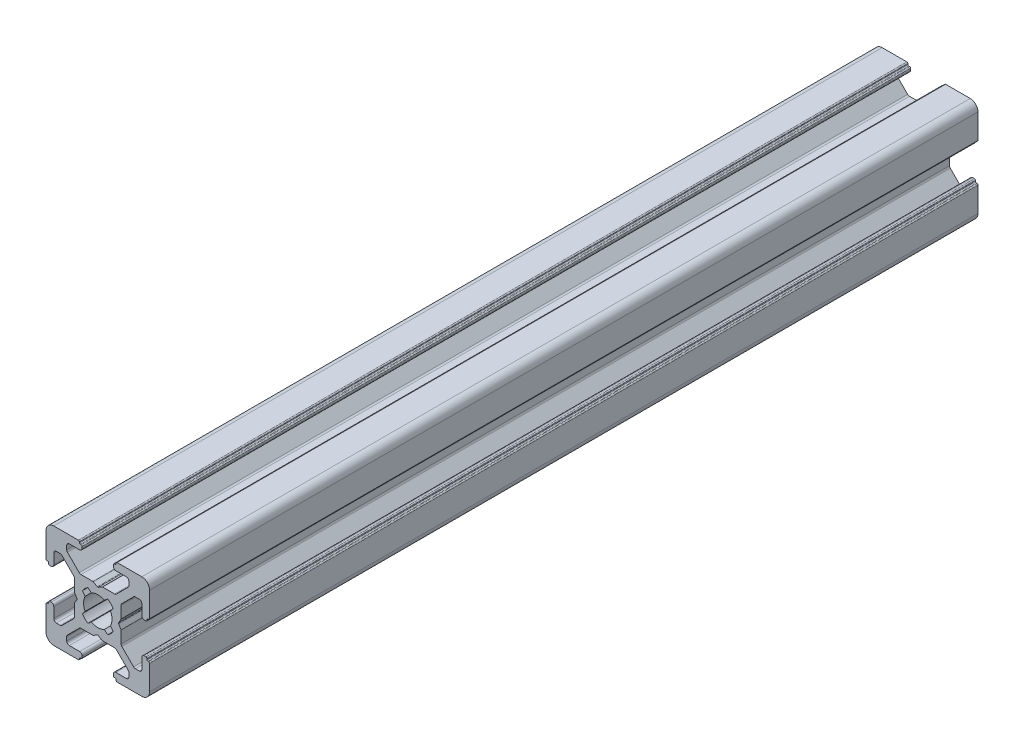
from build123d import *

# Parameters (mm, degrees)
EXTRUDE1_DEPTH = 160


with BuildPart() as part:
    # Sketch1 → Extrude1 (new body)
    with BuildSketch(Plane.XY):
        with BuildLine():
            Line((-3.5, 8.499999673), (-5.500000686, 8.499999673))
            ThreePointArc((-5.500000686, 8.499999673), (-5.853554077, 8.353553064), (-6.000000686, 7.999999673))
            Line((-6.000000686, 7.999999673), (-6.000000686, 7.267766626))
            ThreePointArc((-6.000000686, 7.267766626), (-5.961940448, 7.076424899), (-5.853554059, 6.914213219))
            Line((-5.853554059, 6.914213219), (-3.585787212, 4.646446592))
            ThreePointArc((-3.585787212, 4.646446592), (-3.423575544, 4.538060229), (-3.232233839, 4.5))
            Line((-3.232233839, 4.5), (-0.953590312, 4.5))
            ThreePointArc((-0.953590312, 4.5), (-0.901826505, 4.493185166), (-0.853590316, 4.473205083))
            Line((-0.853590316, 4.473205083), (-0.100000045, 4.038119562))
            ThreePointArc((-0.100000045, 4.038119562), (0, 4.011324632), (0.100000045, 4.038119562))
            Line((0.100000045, 4.038119562), (0.853590316, 4.473205083))
            ThreePointArc((0.853590316, 4.473205083), (0.901826505, 4.493185166), (0.953590312, 4.5))
            Line((0.953590312, 4.5), (3.232233839, 4.5))
            ThreePointArc((3.232233839, 4.5), (3.423575544, 4.538060229), (3.585787212, 4.646446592))
            Line((3.585787212, 4.646446592), (5.853554059, 6.914213219))
            ThreePointArc((5.853554059, 6.914213219), (5.961940448, 7.076424899), (6.000000686, 7.267766626))
            Line((6.000000686, 7.267766626), (6.000000686, 7.999999673))
            ThreePointArc((6.000000686, 7.999999673), (5.853554077, 8.353553064), (5.500000686, 8.499999673))
            Line((5.500000686, 8.499999673), (3.5, 8.499999673))
            ThreePointArc((3.5, 8.499999673), (3.146446609, 8.646446283), (3, 8.999999673))
            Line((3, 8.999999673), (3, 9.3))
            ThreePointArc((3, 9.3), (3.058578644, 9.441421356), (3.2, 9.5))
            Line((3.2, 9.5), (3.350000228, 9.5))
            ThreePointArc((3.350000228, 9.5), (3.491421584, 9.558578644), (3.550000228, 9.7))
            Line((3.550000228, 9.7), (3.550000228, 9.8))
            ThreePointArc((3.550000228, 9.8), (3.608578871, 9.941421356), (3.750000228, 10))
            Line((3.750000228, 10), (8.5, 10))
            ThreePointArc((8.5, 10), (9.560660172, 9.560660172), (10, 8.5))
            Line((10, 8.5), (10, 3.749999605))
            ThreePointArc((10, 3.749999605), (9.941421356, 3.608578248), (9.8, 3.549999605))
            Line((9.8, 3.549999605), (9.699999732, 3.549999605))
            ThreePointArc((9.699999732, 3.549999605), (9.558578376, 3.491420961), (9.499999732, 3.349999605))
            Line((9.499999732, 3.349999605), (9.499999732, 3.2))
            ThreePointArc((9.499999732, 3.2), (9.441421088, 3.058578644), (9.299999732, 3))
            Line((9.299999732, 3), (8.999999732, 3))
            ThreePointArc((8.999999732, 3), (8.646446341, 3.146446609), (8.499999732, 3.5))
            Line((8.499999732, 3.5), (8.499999732, 5.499999605))
            ThreePointArc((8.499999732, 5.499999605), (8.353553123, 5.853552995), (7.999999732, 5.999999605))
            Line((7.999999732, 5.999999605), (7.267766685, 5.999999605))
            ThreePointArc((7.267766685, 5.999999605), (7.076424969, 5.961939371), (6.914213294, 5.853552995))
            Line((6.914213294, 5.853552995), (4.646446398, 3.585786099))
            ThreePointArc((4.646446398, 3.585786099), (4.538060023, 3.423574425), (4.499999789, 3.232232708))
            Line((4.499999789, 3.232232708), (4.499999789, 0.953589302))
            ThreePointArc((4.499999789, 0.953589302), (4.493184953, 0.90182549), (4.473204867, 0.853589297))
            Line((4.473204867, 0.853589297), (4.038119841, 0.099999969))
            ThreePointArc((4.038119841, 0.099999969), (4.011324929, 0), (4.038119841, -0.099999969))
            Line((4.038119841, -0.099999969), (4.473204867, -0.853589297))
            ThreePointArc((4.473204867, -0.853589297), (4.493184953, -0.90182549), (4.499999789, -0.953589302))
            Line((4.499999789, -0.953589302), (4.499999789, -3.232232708))
            ThreePointArc((4.499999789, -3.232232708), (4.538060023, -3.423574425), (4.646446398, -3.585786099))
            Line((4.646446398, -3.585786099), (6.914213294, -5.853552995))
            ThreePointArc((6.914213294, -5.853552995), (7.076424969, -5.961939371), (7.267766685, -5.999999605))
            Line((7.267766685, -5.999999605), (7.999999732, -5.999999605))
            ThreePointArc((7.999999732, -5.999999605), (8.353553123, -5.853552995), (8.499999732, -5.499999605))
            Line((8.499999732, -5.499999605), (8.499999732, -3.5))
            ThreePointArc((8.499999732, -3.5), (8.646446341, -3.146446609), (8.999999732, -3))
            Line((8.999999732, -3), (9.299999732, -3))
            ThreePointArc((9.299999732, -3), (9.441421088, -3.058578644), (9.499999732, -3.2))
            Line((9.499999732, -3.2), (9.499999732, -3.349999605))
            ThreePointArc((9.499999732, -3.349999605), (9.558578376, -3.491420961), (9.699999732, -3.549999605))
            Line((9.699999732, -3.549999605), (9.8, -3.549999605))
            ThreePointArc((9.8, -3.549999605), (9.941421356, -3.608578248), (10, -3.749999605))
            Line((10, -3.749999605), (10, -8.5))
            ThreePointArc((10, -8.5), (9.560660172, -9.560660172), (8.5, -10))
            Line((8.5, -10), (3.750000228, -10))
            ThreePointArc((3.750000228, -10), (3.608578871, -9.941421356), (3.550000228, -9.8))
            Line((3.550000228, -9.8), (3.550000228, -9.7))
            ThreePointArc((3.550000228, -9.7), (3.491421584, -9.558578644), (3.350000228, -9.5))
            Line((3.350000228, -9.5), (3.2, -9.5))
            ThreePointArc((3.2, -9.5), (3.058578644, -9.441421356), (3, -9.3))
            Line((3, -9.3), (3, -8.999999673))
            ThreePointArc((3, -8.999999673), (3.146446609, -8.646446283), (3.5, -8.499999673))
            Line((3.5, -8.499999673), (5.500000686, -8.499999673))
            ThreePointArc((5.500000686, -8.499999673), (5.853554077, -8.353553064), (6.000000686, -7.999999673))
            Line((6.000000686, -7.999999673), (6.000000686, -7.267766626))
            ThreePointArc((6.000000686, -7.267766626), (5.961940448, -7.076424899), (5.853554059, -6.914213219))
            Line((5.853554059, -6.914213219), (3.585787212, -4.646446592))
            ThreePointArc((3.585787212, -4.646446592), (3.423575544, -4.538060229), (3.232233839, -4.5))
            Line((3.232233839, -4.5), (0.953590312, -4.5))
            ThreePointArc((0.953590312, -4.5), (0.901826505, -4.493185166), (0.853590316, -4.473205083))
            Line((0.853590316, -4.473205083), (0.100000045, -4.038119562))
            ThreePointArc((0.100000045, -4.038119562), (0, -4.011324632), (-0.100000045, -4.038119562))
            Line((-0.100000045, -4.038119562), (-0.853590316, -4.473205083))
            ThreePointArc((-0.853590316, -4.473205083), (-0.901826505, -4.493185166), (-0.953590312, -4.5))
            Line((-0.953590312, -4.5), (-3.232233839, -4.5))
            ThreePointArc((-3.232233839, -4.5), (-3.423575544, -4.538060229), (-3.585787212, -4.646446592))
            Line((-3.585787212, -4.646446592), (-5.853554059, -6.914213219))
            ThreePointArc((-5.853554059, -6.914213219), (-5.961940448, -7.076424899), (-6.000000686, -7.267766626))
            Line((-6.000000686, -7.267766626), (-6.000000686, -7.999999673))
            ThreePointArc((-6.000000686, -7.999999673), (-5.853554077, -8.353553064), (-5.500000686, -8.499999673))
            Line((-5.500000686, -8.499999673), (-3.5, -8.499999673))
            ThreePointArc((-3.5, -8.499999673), (-3.146446609, -8.646446283), (-3, -8.999999673))
            Line((-3, -8.999999673), (-3, -9.3))
            ThreePointArc((-3, -9.3), (-3.058578644, -9.441421356), (-3.2, -9.5))
            Line((-3.2, -9.5), (-3.350000228, -9.5))
            ThreePointArc((-3.350000228, -9.5), (-3.491421584, -9.558578644), (-3.550000228, -9.7))
            Line((-3.550000228, -9.7), (-3.550000228, -9.8))
            ThreePointArc((-3.550000228, -9.8), (-3.608578871, -9.941421356), (-3.750000228, -10))
            Line((-3.750000228, -10), (-8.5, -10))
            ThreePointArc((-8.5, -10), (-9.560660172, -9.560660172), (-10, -8.5))
            Line((-10, -8.5), (-10, -3.749999605))
            ThreePointArc((-10, -3.749999605), (-9.941421356, -3.608578248), (-9.8, -3.549999605))
            Line((-9.8, -3.549999605), (-9.699999732, -3.549999605))
            ThreePointArc((-9.699999732, -3.549999605), (-9.558578376, -3.491420961), (-9.499999732, -3.349999605))
            Line((-9.499999732, -3.349999605), (-9.499999732, -3.2))
            ThreePointArc((-9.499999732, -3.2), (-9.441421088, -3.058578644), (-9.299999732, -3))
            Line((-9.299999732, -3), (-8.999999732, -3))
            ThreePointArc((-8.999999732, -3), (-8.646446341, -3.146446609), (-8.499999732, -3.5))
            Line((-8.499999732, -3.5), (-8.499999732, -5.499999605))
            ThreePointArc((-8.499999732, -5.499999605), (-8.353553123, -5.853552995), (-7.999999732, -5.999999605))
            Line((-7.999999732, -5.999999605), (-7.267766685, -5.999999605))
            ThreePointArc((-7.267766685, -5.999999605), (-7.076424969, -5.961939371), (-6.914213294, -5.853552995))
            Line((-6.914213294, -5.853552995), (-4.646446398, -3.585786099))
            ThreePointArc((-4.646446398, -3.585786099), (-4.538060023, -3.423574425), (-4.499999789, -3.232232708))
            Line((-4.499999789, -3.232232708), (-4.499999789, -0.953589302))
            ThreePointArc((-4.499999789, -0.953589302), (-4.493184953, -0.90182549), (-4.473204867, -0.853589297))
            Line((-4.473204867, -0.853589297), (-4.038119841, -0.099999969))
            ThreePointArc((-4.038119841, -0.099999969), (-4.011324929, 0), (-4.038119841, 0.099999969))
            Line((-4.038119841, 0.099999969), (-4.473204867, 0.853589297))
            ThreePointArc((-4.473204867, 0.853589297), (-4.493184953, 0.90182549), (-4.499999789, 0.953589302))
            Line((-4.499999789, 0.953589302), (-4.499999789, 3.232232708))
            ThreePointArc((-4.499999789, 3.232232708), (-4.538060023, 3.423574425), (-4.646446398, 3.585786099))
            Line((-4.646446398, 3.585786099), (-6.914213294, 5.853552995))
            ThreePointArc((-6.914213294, 5.853552995), (-7.076424969, 5.961939371), (-7.267766685, 5.999999605))
            Line((-7.267766685, 5.999999605), (-7.999999732, 5.999999605))
            ThreePointArc((-7.999999732, 5.999999605), (-8.353553123, 5.853552995), (-8.499999732, 5.499999605))
            Line((-8.499999732, 5.499999605), (-8.499999732, 3.5))
            ThreePointArc((-8.499999732, 3.5), (-8.646446341, 3.146446609), (-8.999999732, 3))
            Line((-8.999999732, 3), (-9.299999732, 3))
            ThreePointArc((-9.299999732, 3), (-9.441421088, 3.058578644), (-9.499999732, 3.2))
            Line((-9.499999732, 3.2), (-9.499999732, 3.349999605))
            ThreePointArc((-9.499999732, 3.349999605), (-9.558578376, 3.491420961), (-9.699999732, 3.549999605))
            Line((-9.699999732, 3.549999605), (-9.8, 3.549999605))
            ThreePointArc((-9.8, 3.549999605), (-9.941421356, 3.608578248), (-10, 3.749999605))
            Line((-10, 3.749999605), (-10, 8.5))
            ThreePointArc((-10, 8.5), (-9.560660172, 9.560660172), (-8.5, 10))
            Line((-8.5, 10), (-3.750000228, 10))
            ThreePointArc((-3.750000228, 10), (-3.608578871, 9.941421356), (-3.550000228, 9.8))
            Line((-3.550000228, 9.8), (-3.550000228, 9.7))
            ThreePointArc((-3.550000228, 9.7), (-3.491421584, 9.558578644), (-3.350000228, 9.5))
            Line((-3.350000228, 9.5), (-3.2, 9.5))
            ThreePointArc((-3.2, 9.5), (-3.058578644, 9.441421356), (-3, 9.3))
            Line((-3, 9.3), (-3, 8.999999673))
            ThreePointArc((-3, 8.999999673), (-3.146446609, 8.646446283), (-3.5, 8.499999673))
        make_face()
        with BuildLine():
            Line((-1.258185436, 2.445295362), (-1.91389502, 2.989640962))
            ThreePointArc((-1.91389502, 2.989640962), (-2.511737261, 2.508410485), (-2.992174953, 1.909930962))
            Line((-2.992174953, 1.909930962), (-2.445295423, 1.258185317))
            ThreePointArc((-2.445295423, 1.258185317), (-2.75, 0), (-2.445295423, -1.258185317))
            Line((-2.445295423, -1.258185317), (-2.992174953, -1.909930962))
            ThreePointArc((-2.992174953, -1.909930962), (-2.511737261, -2.508410485), (-1.91389502, -2.989640962))
            Line((-1.91389502, -2.989640962), (-1.258185436, -2.445295362))
            ThreePointArc((-1.258185436, -2.445295362), (0, -2.75), (1.258185436, -2.445295362))
            Line((1.258185436, -2.445295362), (1.91389502, -2.989640962))
            ThreePointArc((1.91389502, -2.989640962), (2.511737261, -2.508410485), (2.992174953, -1.909930962))
            Line((2.992174953, -1.909930962), (2.445295423, -1.258185317))
            ThreePointArc((2.445295423, -1.258185317), (2.75, 0), (2.445295423, 1.258185317))
            Line((2.445295423, 1.258185317), (2.992174953, 1.909930962))
            ThreePointArc((2.992174953, 1.909930962), (2.511737261, 2.508410485), (1.91389502, 2.989640962))
            Line((1.91389502, 2.989640962), (1.258185436, 2.445295362))
            ThreePointArc((1.258185436, 2.445295362), (0, 2.75), (-1.258185436, 2.445295362))
        make_face(mode=Mode.SUBTRACT)
    extrude(amount=EXTRUDE1_DEPTH)


solid = part.part
